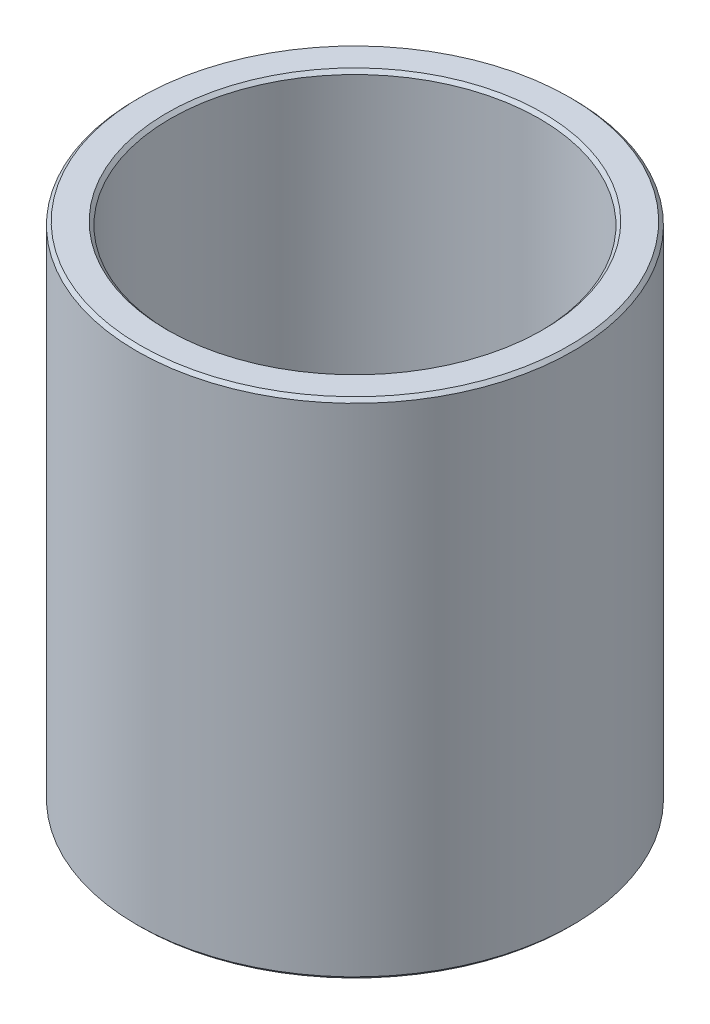
from build123d import *

# Parameters (mm, degrees)
SKETCH1_R           = 13
SKETCH1_R_2         = 11
BOSS_EXTRUDE1_DEPTH = 30
CHAMFER1_SIZE       = 0.2


with BuildPart() as part:
    # Sketch1 → Boss-Extrude1 (new body)
    with BuildSketch(Plane(origin=(0, 0, 0), x_dir=(1, 0, 0), z_dir=(0, 1, 0))):
        with Locations(Location((0, 0, 0), (0, 0, 270))):
            Circle(SKETCH1_R)
        with Locations(Location((0, 0, 0), (0, 0, 270))):
            Circle(SKETCH1_R_2, mode=Mode.SUBTRACT)
    extrude(amount=BOSS_EXTRUDE1_DEPTH)

    # Chamfer1
    chamfer1_edges = [part.edges().sort_by_distance(p)[0] for p in [
        (0, 0, -13),
        (0, 30, -13),
        (0, 0, -11),
        (0, 30, -11),
    ]]
    chamfer(chamfer1_edges, length=CHAMFER1_SIZE)


solid = part.part
